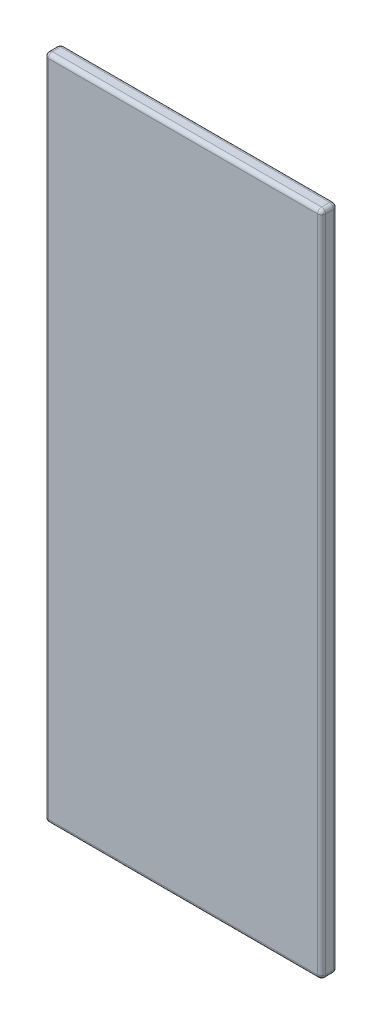
from build123d import *

# Parameters (mm, degrees)
SKETCH1_W           = 34.7
SKETCH1_H           = 83.5
BOSS_EXTRUDE1_DEPTH = 2
FILLET1_R           = 0.5


with BuildPart() as part:
    # Sketch1 → Boss-Extrude1 (new body)
    with BuildSketch(Plane.XY):
        Rectangle(SKETCH1_W, SKETCH1_H)
    extrude(amount=BOSS_EXTRUDE1_DEPTH)

    # Fillet1
    fillet1_edges = [part.edges().sort_by_distance(p)[0] for p in [
        (-17.35, 0, 2),
        (0, -41.75, 2),
        (17.35, 0, 2),
        (0, -41.75, 0),
        (-17.35, 0, 0),
        (0, 41.75, 0),
        (17.35, 0, 0),
        (17.35, -41.75, 1),
        (-17.35, -41.75, 1),
        (-17.35, 41.75, 1),
        (17.35, 41.75, 1),
        (0, 41.75, 2),
    ]]
    fillet(fillet1_edges, radius=FILLET1_R)


solid = part.part
